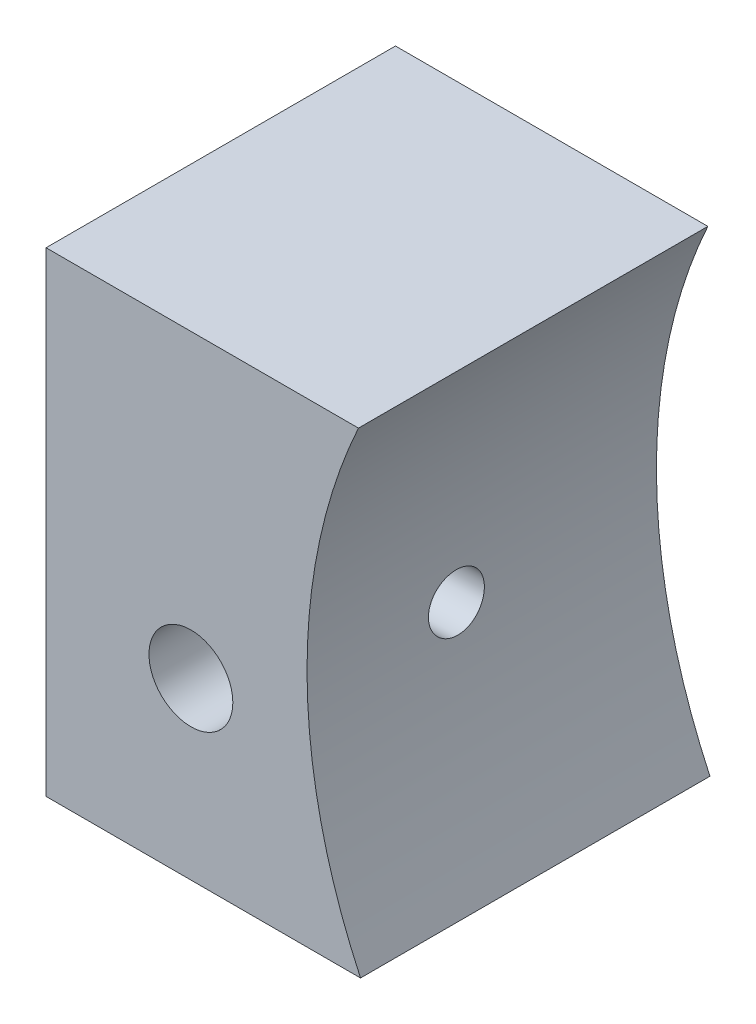
from build123d import *

# Parameters (mm, degrees)
BOSS_EXTRU_1_DEPTH                = 50
COQUE2_T                          = -10
TROU_TARAUD_0_801_D               = 12
TROU_DE_PASSAGE_D_AXE_3_321_D     = 8.0000094
TROU_DE_PASSAGE_D_AXE_3_321_DEPTH = 10


with BuildPart() as part:
    # Esquisse1 → Boss.-Extru.1 (new body)
    with BuildSketch(Plane.XY):
        with BuildLine():
            Line((0, 0), (0, 68))
            Line((0, 68), (44.704064579, 68))
            ThreePointArc((44.704064579, 68), (37.345127658, 33.967330015), (45, 0))
            Line((45, 0), (0, 0))
        make_face()
    extrude(amount=BOSS_EXTRU_1_DEPTH)

    # Coque2
    coque2_openings = [part.faces().sort_by_distance(p)[0] for p in [
        (19.961549488, 33.959529951, 0),
    ]]
    offset(amount=COQUE2_T, openings=coque2_openings, kind=Kind.INTERSECTION)

    # Trou taraudé #0-801 (through all)
    with Locations(Plane.XY.offset(50)):
        with Locations((20.726437539, 25)):
            Hole(TROU_TARAUD_0_801_D / 2)

    # Trou de passage d'axe 3/321
    with Locations(Plane(origin=(37.374610437, 32.108761201, 28.657882027), x_dir=(-0.027368282342, 0.999625418405, 0), z_dir=(0.999625418405, 0.027368282342, 0))):
        with Locations((0, 0)):
            Hole(TROU_DE_PASSAGE_D_AXE_3_321_D / 2, depth=TROU_DE_PASSAGE_D_AXE_3_321_DEPTH)


solid = part.part
